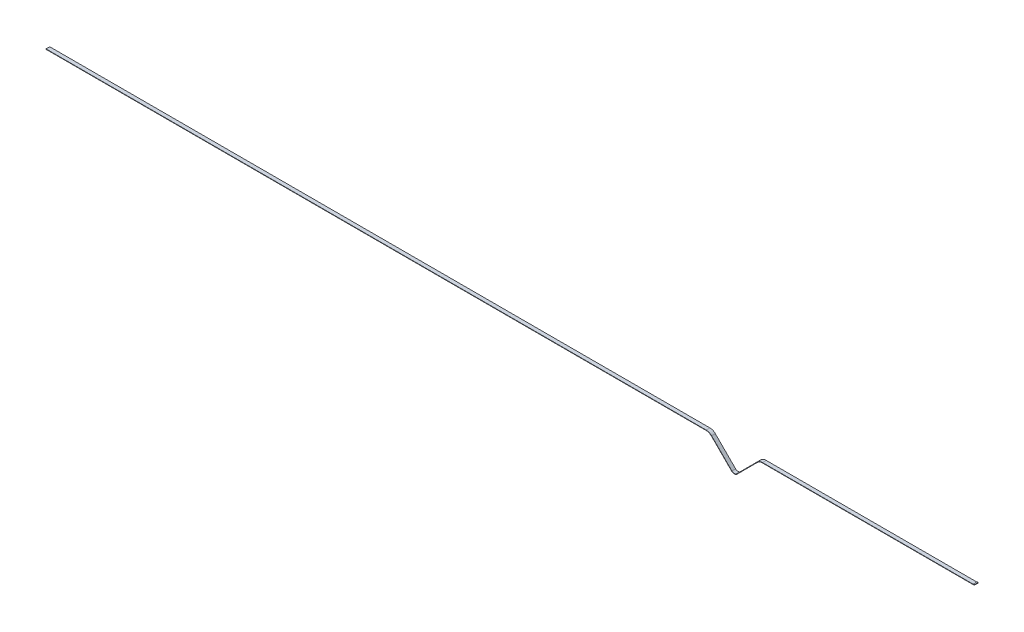
from build123d import *

# Parameters (mm, degrees)
SKETCH1_W           = 6
SKETCH1_H           = 0.63
BOSS_EXTRUDE1_DEPTH = 6


with BuildPart() as part:
    # Sweep1: sweep along a path in Sketch2
    with BuildLine(Plane.XY) as sweep1_path:
        Line((0, 0), (-342.20186112, 0))
        ThreePointArc((-342.20186112, 0), (-346.778350853, -0.911057943), (-350.657025134, -3.505315192))
        Line((-350.657025134, -3.505315192), (-383.448760524, -36.337742609))
        ThreePointArc((-383.448760524, -36.337742609), (-387.77186112, -38.13), (-392.094961716, -36.337742609))
        Line((-392.094961716, -36.337742609), (-424.886697107, -3.505315192))
        ThreePointArc((-424.886697107, -3.505315192), (-428.765371388, -0.911057943), (-433.34186112, 0))
        Line((-433.34186112, 0), (-1500, 0))
    # Sketch1 → Sweep1 (sweep)
    with BuildSketch(Plane(origin=(0, 0, 0), x_dir=(0, 0, -1), z_dir=(1, 0, 0))):
        with Locations((3, 0.315)):
            Rectangle(SKETCH1_W, SKETCH1_H)
    sweep(path=sweep1_path.line)

    # Sketch3 → Boss-Extrude1 (add, through all)
    with BuildSketch(Plane.XY):
        with BuildLine():
            Line((-1.5, 0.63), (-1.5, 0))
            Line((-1.5, 0), (0, 0))
            Line((0, 0), (0, 0.63))
            ThreePointArc((0, 0.63), (-0.75, 1.38), (-1.5, 0.63))
        make_face()
    extrude(amount=-BOSS_EXTRUDE1_DEPTH)


solid = part.part
